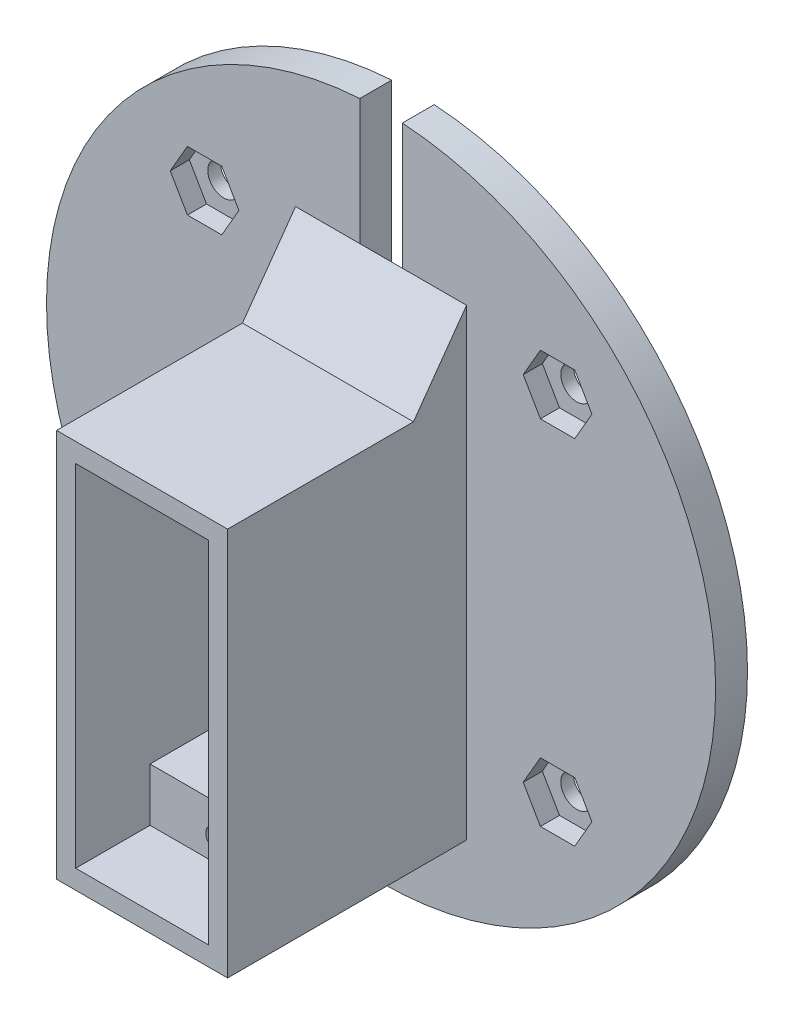
from build123d import *

# Parameters (mm, degrees)
CROQUIS1_R              = 31.5
SALIENTE_EXTRUIR1_DEPTH = 2.4
CROQUIS2_W              = 16.1
CROQUIS2_H              = 36.6
CROQUIS2_W_2            = 12.5
CROQUIS2_H_2            = 33
SALIENTE_EXTRUIR2_DEPTH = 22.5
CROQUIS5_W              = 16.1
CROQUIS5_H              = 36.6
CORTAR_EXTRUIR2_DEPTH   = 9
CROQUIS6_R              = 1.5
CORTAR_EXTRUIR3_DEPTH   = 2.4
CROQUIS7_W              = 12.5
CROQUIS7_H              = 9
SALIENTE_EXTRUIR3_DEPTH = 33
CROQUIS8_R              = 1
CORTAR_EXTRUIR5_DEPTH   = 9
SALIENTE_EXTRUIR4_DEPTH = 12.5
CROQUIS10_W             = 4
CROQUIS10_H             = 2
CORTAR_EXTRUIR6_DEPTH   = 9
SALIENTE_EXTRUIR5_DEPTH = 2.4
SALIENTE_EXTRUIR6_DEPTH = 16.1
CORTAR_EXTRUIR7_DEPTH   = 1.8
CROQUIS14_R             = 1.5
SALIENTE_EXTRUIR7_DEPTH = 0.6


with BuildPart() as part:
    # Croquis1 → Saliente-Extruir1 (new body)
    with BuildSketch(Plane.XY):
        with Locations((-51.235671923, 9.786589019)):
            Circle(CROQUIS1_R)
    extrude(amount=SALIENTE_EXTRUIR1_DEPTH)

    # Croquis2 → Saliente-Extruir2 (add)
    with BuildSketch(Plane.XY.offset(2.4)):
        with Locations((-51.235671923, 4.086589019)):
            Rectangle(CROQUIS2_W, CROQUIS2_H)
        with Locations((-51.235671923, 4.086589019)):
            Rectangle(CROQUIS2_W_2, CROQUIS2_H_2, mode=Mode.SUBTRACT)
    extrude(amount=SALIENTE_EXTRUIR2_DEPTH)

    # Croquis5 → Cortar-Extruir2 (cut)
    with BuildSketch(Plane.XY.offset(2.4)):
        with Locations((-51.235671923, 4.086589019)):
            Rectangle(CROQUIS5_W, CROQUIS5_H)
    extrude(amount=-CORTAR_EXTRUIR2_DEPTH, mode=Mode.SUBTRACT)


with BuildPart() as cortar_extruir2_piece_1:
    # of the separate pieces the step leaves, piece 1, a body of its own (cortar_extruir2_pieces)
    add(part.part.solids().sort_by_distance((-19.735671923, 9.786589019, 0))[0])

    # Croquis6 → Cortar-Extruir3 (cut)
    with BuildSketch(Plane(origin=(0, 0, 0), x_dir=(-1, 0, 0), z_dir=(0, 0, -1))):
        with Locations((34.618662565, 26.403598377)):
            Circle(CROQUIS6_R)
        with Locations((67.85268128, 26.403598377)):
            Circle(CROQUIS6_R)
        with Locations((67.85268128, -6.830420339)):
            Circle(CROQUIS6_R)
        with Locations((34.618662565, -6.830420339)):
            Circle(CROQUIS6_R)
        Polygon((51.235671923, 22.386589019), (53.235671923, 22.386589019), (53.235671923, 42.386589019), (49.235671923, 42.386589019), (49.235671923, 22.386589019), align=None)
    extrude(amount=-CORTAR_EXTRUIR3_DEPTH, mode=Mode.SUBTRACT)



with BuildPart() as cortar_extruir2_piece_2:
    # of the separate pieces the step leaves, piece 2, a body of its own (cortar_extruir2_pieces)
    add(part.part.solids().sort_by_distance((-59.285671923, -14.213410981, 24.9))[0])

    # Croquis7 → Saliente-Extruir3 (add)
    with BuildSketch(Plane.XZ.offset(-20.586589019)):
        with Locations((-51.235671923, 13.4)):
            Rectangle(CROQUIS7_W, CROQUIS7_H)
    extrude(amount=SALIENTE_EXTRUIR3_DEPTH)

    # Croquis8 → Cortar-Extruir5 (cut)
    with BuildSketch(Plane.XY.offset(17.9)):
        with Locations((-51.235671923, -10.413410981)):
            Circle(CROQUIS8_R)
        with Locations((-51.235671923, 18.636589019)):
            Circle(CROQUIS8_R)
        Polygon((-44.985671923, -7.413410981), (-57.485671923, -7.413410981), (-57.485671923, 15.586589019), (-53.235671923, 15.586589019), (-53.235671923, 17.586589019), (-49.235671923, 17.586589019), (-49.235671923, 15.586589019), (-44.985671923, 15.586589019), align=None)
    extrude(amount=-CORTAR_EXTRUIR5_DEPTH, mode=Mode.SUBTRACT)

    # Croquis9 → Saliente-Extruir4 (add)
    with BuildSketch(Plane.ZY.offset(44.985671923)):
        Polygon((8.9, -7.413410981), (3.9, -12.413410981), (8.9, -12.413410981), align=None)
        Polygon((8.9, 15.586589019), (3.9, 20.586589019), (8.9, 20.586589019), align=None)
    extrude(amount=SALIENTE_EXTRUIR4_DEPTH)

    # Croquis10 → Cortar-Extruir6 (cut)
    with BuildSketch(Plane.XY.offset(8.9)):
        with Locations((-51.235671923, 16.586589019)):
            Rectangle(CROQUIS10_W, CROQUIS10_H)
    extrude(amount=-CORTAR_EXTRUIR6_DEPTH, mode=Mode.SUBTRACT)


with BuildPart() as cortar_extruir2_piece_1_1:
    add(cortar_extruir2_piece_1.part)

    add(cortar_extruir2_piece_2.part)  # Saliente-Extruir5 merges Cortar-Extruir2 piece 2
    # Croquis11 → Saliente-Extruir5 (add)
    with BuildSketch(Plane(origin=(0, 0, 2.4), x_dir=(-1, 0, 0), z_dir=(0, 0, -1))):
        Polygon((49.235671923, 22.386589019), (43.185671923, 22.386589019), (43.185671923, -14.213410981), (59.285671923, -14.213410981), (59.285671923, 22.386589019), (53.235671923, 22.386589019), (53.235671923, 20.586589019), (57.485671923, 20.586589019), (57.485671923, 10.586589019), (44.985671923, 10.586589019), (44.985671923, 20.586589019), (49.235671923, 20.586589019), align=None)
    extrude(amount=SALIENTE_EXTRUIR5_DEPTH)

    # Croquis12 → Saliente-Extruir6 (add)
    with BuildSketch(Plane(origin=(-43.185671923, 0, 0), x_dir=(0, 0, -1), z_dir=(1, 0, 0))):
        Polygon((-2.4, 22.386589019), (-7.4, 22.386589019), (-2.4, 29.386589019), align=None)
    extrude(amount=-SALIENTE_EXTRUIR6_DEPTH)

    # Croquis13 → Cortar-Extruir7 (cut)
    with BuildSketch(Plane.XY.offset(2.4)):
        Polygon((-31.385501057, -6.830420339), (-33.002081811, -4.030420339), (-36.235243318, -4.030420339), (-37.851824072, -6.830420339), (-36.235243318, -9.630420339), (-33.002081811, -9.630420339), align=None)
        Polygon((-64.619519773, -6.830420339), (-66.236100527, -4.030420339), (-69.469262034, -4.030420339), (-71.085842788, -6.830420339), (-69.469262034, -9.630420339), (-66.236100527, -9.630420339), align=None)
        Polygon((-37.851824072, 26.403598377), (-36.235243318, 23.603598377), (-33.002081811, 23.603598377), (-31.385501057, 26.403598377), (-33.002081811, 29.203598377), (-36.235243318, 29.203598377), align=None)
        Polygon((-71.085842788, 26.403598377), (-69.469262034, 23.603598377), (-66.236100527, 23.603598377), (-64.619519773, 26.403598377), (-66.236100527, 29.203598377), (-69.469262034, 29.203598377), align=None)
    extrude(amount=-CORTAR_EXTRUIR7_DEPTH, mode=Mode.SUBTRACT)

    # Croquis14 → Saliente-Extruir7 (add)
    with BuildSketch(Plane(origin=(0, 0, 0), x_dir=(-1, 0, 0), z_dir=(0, 0, -1))):
        with BuildLine():
            Line((53.235671923, 41.223032838), (53.235671923, 20.586589019))
            Line((53.235671923, 20.586589019), (57.485671923, 20.586589019))
            Line((57.485671923, 20.586589019), (57.485671923, 10.586589019))
            Line((57.485671923, 10.586589019), (44.985671923, 10.586589019))
            Line((44.985671923, 10.586589019), (44.985671923, 20.586589019))
            Line((44.985671923, 20.586589019), (49.235671923, 20.586589019))
            Line((49.235671923, 20.586589019), (49.235671923, 41.223032838))
            ThreePointArc((49.235671923, 41.223032838), (51.235671923, -21.713410981), (53.235671923, 41.223032838))
        make_face()
        with Locations((67.85268128, -6.830420339)):
            Circle(CROQUIS14_R, mode=Mode.SUBTRACT)
        with Locations((34.618662565, -6.830420339)):
            Circle(CROQUIS14_R, mode=Mode.SUBTRACT)
        with Locations((34.618662565, 26.403598377)):
            Circle(CROQUIS14_R, mode=Mode.SUBTRACT)
        with Locations((67.85268128, 26.403598377)):
            Circle(CROQUIS14_R, mode=Mode.SUBTRACT)
    extrude(amount=SALIENTE_EXTRUIR7_DEPTH)


solid = cortar_extruir2_piece_1_1.part
